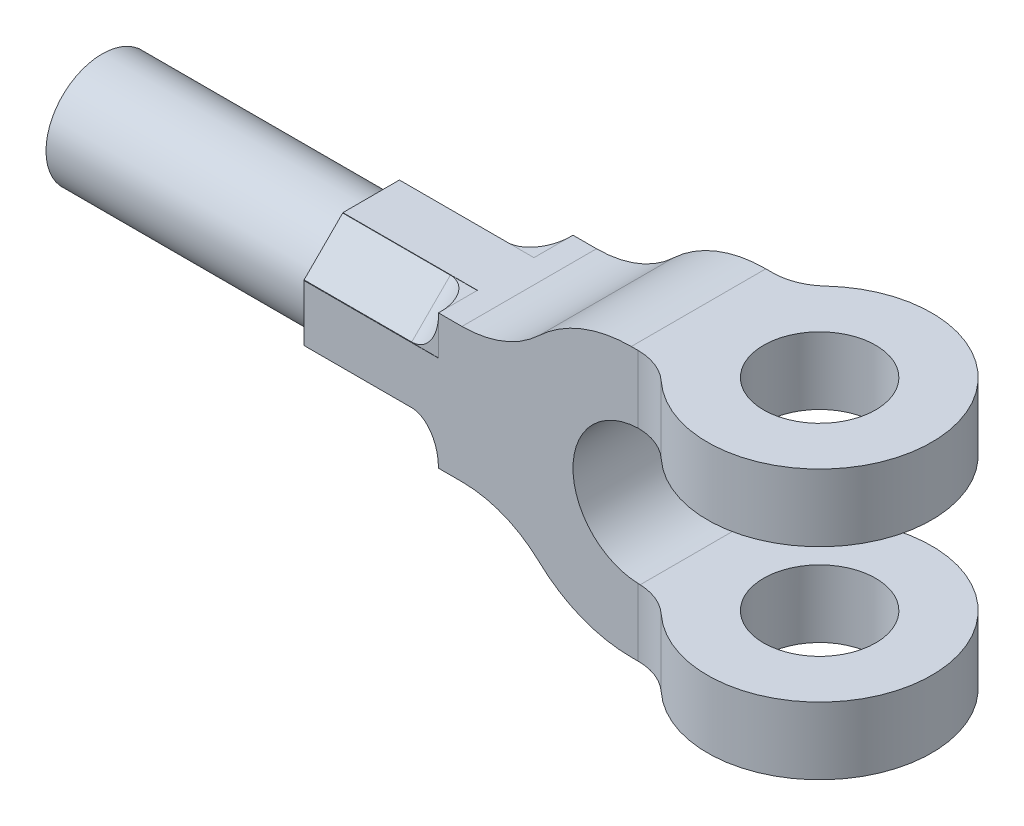
from build123d import *

# Parameters (mm, degrees)
SKETCH2_W           = 120
SKETCH2_H           = 250
BOSS_EXTRUDE1_DEPTH = 100
CUT_EXTRUDE1_DEPTH  = 295.78805946
SKETCH4_OUTSIDE_W   = 310.958
SKETCH4_OUTSIDE_H   = 160.958
SKETCH4_OUTSIDE_R   = 25
CUT_EXTRUDE2_DEPTH  = 295.78805946
CUT_EXTRUDE6_DEPTH  = 60
SKETCH5_4_R         = 25
BOSS_EXTRUDE3_DEPTH = 120
SKETCH6_W           = 60
SKETCH6_H           = 17.4
CUT_EXTRUDE7_DEPTH  = 0.1
SKETCH7_W           = 60
SKETCH7_H           = 17.4
CUT_EXTRUDE8_DEPTH  = 0.1
SKETCH8_W           = 60
SKETCH8_H           = 17.4
CUT_EXTRUDE9_DEPTH  = 0.1
FILLET5_R           = 12
FILLET6_R           = 12


with BuildPart() as part:
    # Sketch2 → Boss-Extrude1 (new body)
    with BuildSketch(Plane(origin=(0, 0, 0), x_dir=(0, 1, 0), z_dir=(0, 0, 1))):
        with Locations((-60, 125)):
            Rectangle(SKETCH2_W, SKETCH2_H)
    extrude(amount=BOSS_EXTRUDE1_DEPTH)

    # Sketch3 → Cut-Extrude1 (cut, through all)
    with BuildSketch(Plane.XY.offset(100)):
        with BuildLine():
            ThreePointArc((-100, -30), (-130, -60), (-100, -90))
            Line((-100, -90), (0, -90))
            Line((0, -90), (0, -30))
            Line((0, -30), (-100, -30))
        make_face()
        with BuildLine():
            Line((-250, 0), (-250, -30))
            Line((-250, -30), (-179.498344353, -30))
            ThreePointArc((-179.498344353, -30), (-161.034620706, -26.466018864), (-145.180915101, -16.363636364))
            ThreePointArc((-145.180915101, -16.363636364), (-126.156468376, -4.240777363), (-104, 0))
            Line((-104, 0), (-250, 0))
        make_face()
        with BuildLine():
            Line((-179.498344353, -90), (-250, -90))
            Line((-250, -90), (-250, -120))
            Line((-250, -120), (-103.999999784, -120))
            ThreePointArc((-103.999999784, -120), (-126.156468276, -115.759222677), (-145.180915101, -103.636363636))
            ThreePointArc((-145.180915101, -103.636363636), (-161.034620706, -93.533981136), (-179.498344353, -90))
        make_face()
    extrude(amount=-CUT_EXTRUDE1_DEPTH, mode=Mode.SUBTRACT)

    # Sketch4 outside → Cut-Extrude2 (cut, through all)
    # profile 1 of 2: a face of its own
    with BuildSketch(Plane(origin=(0, 0, 0), x_dir=(-1, 0, 0), z_dir=(0, 1, 0))):
        with Locations((125, 50)):
            Rectangle(SKETCH4_OUTSIDE_W, SKETCH4_OUTSIDE_H)
        with BuildLine():
            Line((250, 80), (100.990195136, 80))
            ThreePointArc((100.990195136, 80), (91.861485844, 81.726266594), (83.993463424, 86.666666667))
            ThreePointArc((83.993463424, 86.666666667), (0, 50), (83.993463424, 13.333333333))
            ThreePointArc((83.993463424, 13.333333333), (91.861485844, 18.273733406), (100.990195136, 20))
            Line((100.990195136, 20), (250, 20))
            Line((250, 20), (250, 80))
        make_face(mode=Mode.SUBTRACT)
    # profile 2 of 2: a face of its own
    with BuildSketch(Plane(origin=(0, 0, 0), x_dir=(-1, 0, 0), z_dir=(0, 1, 0))):
        with Locations((50, 50)):
            Circle(SKETCH4_OUTSIDE_R)
    extrude(amount=-CUT_EXTRUDE2_DEPTH, mode=Mode.SUBTRACT)

    # Sketch5 → Cut-Extrude6 (cut)
    with BuildSketch(Plane(origin=(-250, 0, 0), x_dir=(0, -1, 0), z_dir=(-1, 0, 0))):
        Polygon((72.6, 80), (90, 62.6), (90, 80), align=None)
        Polygon((72.608172947, 20.008172947), (90.008172947, 20.008172947), (90.008172947, 37.408172947), align=None)
        Polygon((30.016345893, 37.4), (30.016345893, 20), (47.416345893, 20), align=None)
        Polygon((47.408172947, 79.991827053), (30.008172947, 79.991827053), (30.008172947, 62.591827053), align=None)
    extrude(amount=-CUT_EXTRUDE6_DEPTH, mode=Mode.SUBTRACT)

    # Sketch5<4> → Boss-Extrude3 (add)
    with BuildSketch(Plane(origin=(-250, 0, 0), x_dir=(0, -1, 0), z_dir=(-1, 0, 0))):
        with Locations((60.008172947, 50)):
            Circle(SKETCH5_4_R)
    extrude(amount=BOSS_EXTRUDE3_DEPTH)

    # Sketch6 → Cut-Extrude7 (cut)
    with BuildSketch(Plane(origin=(0, -30, 0), x_dir=(1, 0, 0), z_dir=(0, 1, 0))):
        with Locations((-220, -71.3)):
            Rectangle(SKETCH6_W, SKETCH6_H)
        with Locations((-220, -28.7)):
            Rectangle(SKETCH6_W, SKETCH6_H)
    extrude(amount=-CUT_EXTRUDE7_DEPTH, mode=Mode.SUBTRACT)

    # Sketch7 → Cut-Extrude8 (cut)
    with BuildSketch(Plane(origin=(0, 0, 20), x_dir=(-1, 0, 0), z_dir=(0, 0, -1))):
        with Locations((220, -81.3)):
            Rectangle(SKETCH7_W, SKETCH7_H)
    extrude(amount=-CUT_EXTRUDE8_DEPTH, mode=Mode.SUBTRACT)

    # Sketch8 → Cut-Extrude9 (cut)
    with BuildSketch(Plane.XY.offset(80)):
        with Locations((-220, -38.8)):
            Rectangle(SKETCH8_W, SKETCH8_H)
    extrude(amount=-CUT_EXTRUDE9_DEPTH, mode=Mode.SUBTRACT)

    # Fillet5
    fillet5_edges = [part.edges().sort_by_distance(p)[0] for p in [
        (-190, -38.708172947, 71.291827053),
    ]]
    fillet(fillet5_edges, radius=FILLET5_R)

    # Fillet6
    fillet6_edges = [part.edges().sort_by_distance(p)[0] for p in [
        (-190, -81.3, 71.3),
        (-190, -81.35, 28.75),
        (-190, -38.758172947, 28.658172947),
    ]]
    fillet(fillet6_edges, radius=FILLET6_R)


solid = part.part
